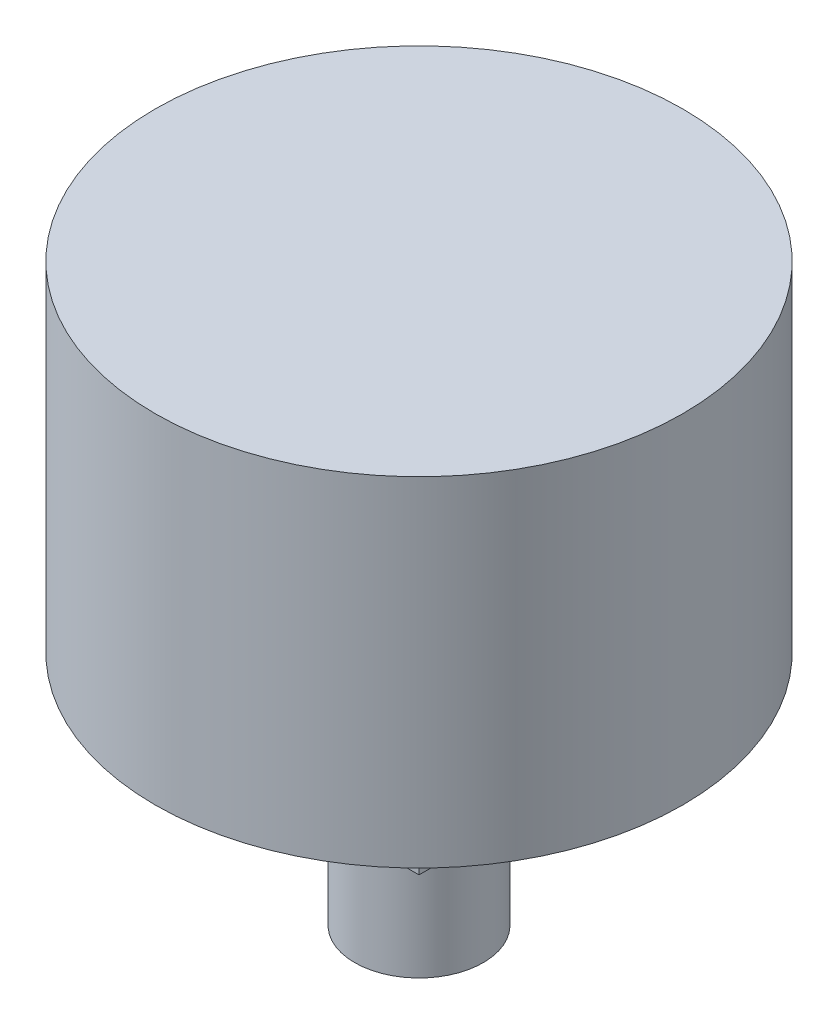
from build123d import *

# Parameters (mm, degrees)
SKETCH1_R           = 20.32
BOSS_EXTRUDE1_DEPTH = 26.0985
SKETCH2_W           = 14.0462
SKETCH2_H           = 14.0462
BOSS_EXTRUDE2_DEPTH = 7.7978
SKETCH3_R           = 4.953
BOSS_EXTRUDE3_DEPTH = 10.4013


with BuildPart() as part:
    # Sketch1 → Boss-Extrude1 (new body)
    with BuildSketch(Plane(origin=(0, 0, 0), x_dir=(1, 0, 0), z_dir=(0, 1, 0))):
        with Locations(Location((0, 0, 0), (0, 0, 270))):
            Circle(SKETCH1_R)
    extrude(amount=BOSS_EXTRUDE1_DEPTH)

    # Sketch2 → Boss-Extrude2 (add)
    with BuildSketch(Plane.XZ):
        Rectangle(SKETCH2_W, SKETCH2_H)
    extrude(amount=BOSS_EXTRUDE2_DEPTH)

    # Sketch3 → Boss-Extrude3 (add)
    with BuildSketch(Plane.XZ.offset(7.7978)):
        with Locations(Location((0, 0, 0), (0, 0, 90))):
            Circle(SKETCH3_R)
    extrude(amount=BOSS_EXTRUDE3_DEPTH)


solid = part.part
